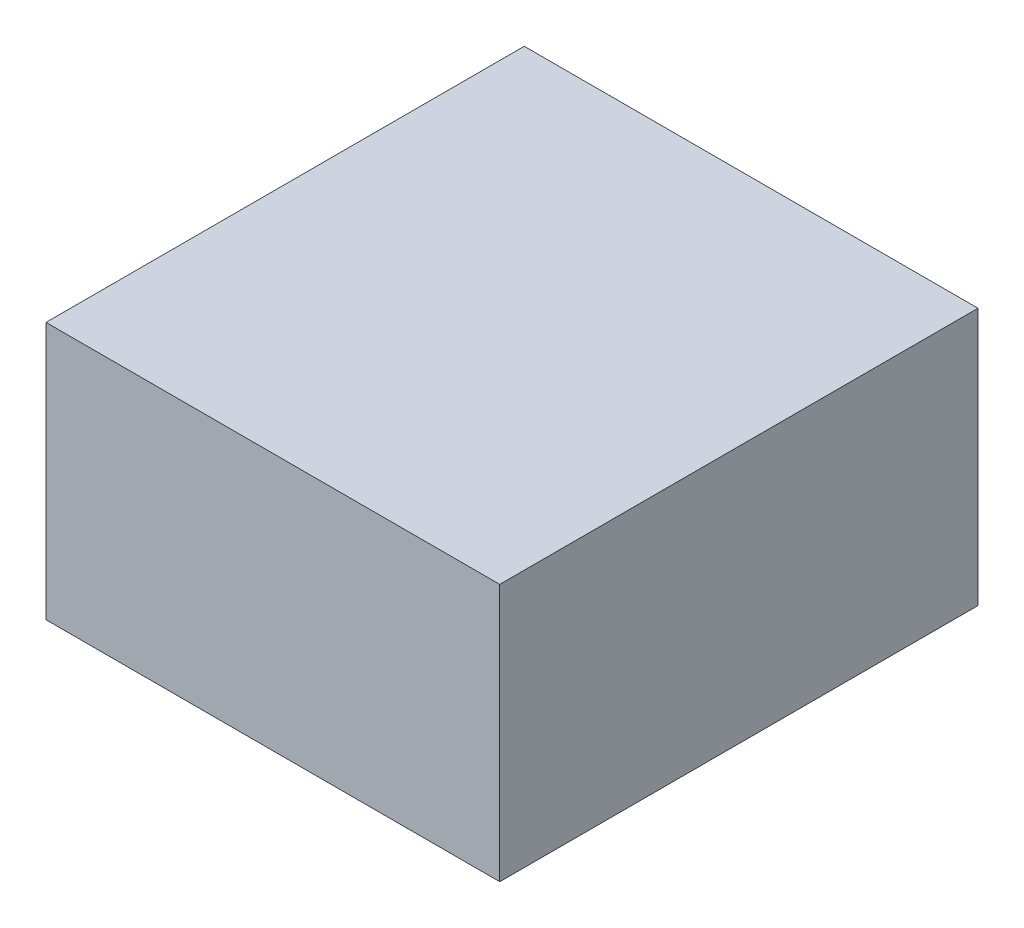
from build123d import *

# Parameters (mm, degrees)
SKETCH1_W           = 370
SKETCH1_H           = 390
BOSS_EXTRUDE1_DEPTH = 210


with BuildPart() as part:
    # Sketch1 → Boss-Extrude1 (new body)
    with BuildSketch(Plane(origin=(0, 0, 0), x_dir=(1, 0, 0), z_dir=(0, 1, 0))):
        Rectangle(SKETCH1_W, SKETCH1_H)
    extrude(amount=BOSS_EXTRUDE1_DEPTH)


solid = part.part
